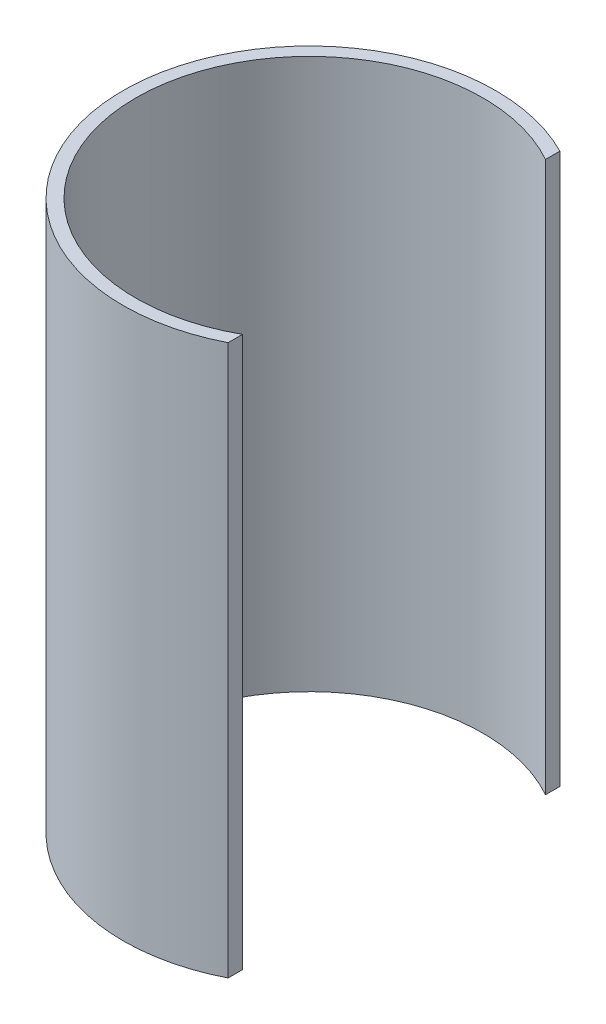
from build123d import *

# Parameters (mm, degrees)
EXTRUDE_1_DEPTH = 130


with BuildPart() as part:
    # 草图1 → 凸台-拉伸1 (new body)
    with BuildSketch(Plane(origin=(0, 0, 0), x_dir=(1, 0, 0), z_dir=(0, 1, 0))):
        with BuildLine():
            Line((20, 39.191835885), (20, 35.791060336))
            ThreePointArc((20, 35.791060336), (-41, 0), (20, -35.791060336))
            Line((20, -35.791060336), (20, -39.191835885))
            ThreePointArc((20, -39.191835885), (-44, 0), (20, 39.191835885))
        make_face()
    extrude(amount=EXTRUDE_1_DEPTH)


solid = part.part
